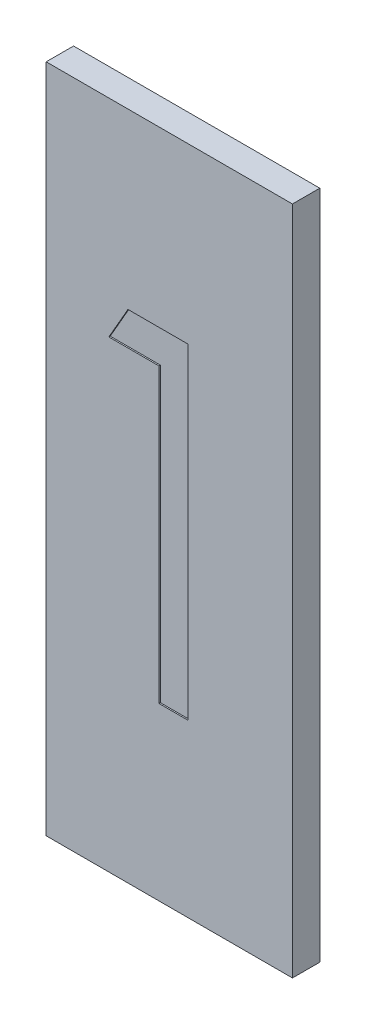
from build123d import *

# Parameters (mm, degrees)
SKETCH_1_W          = 18
SKETCH_1_H          = 49
EXTRUDE_1_DEPTH     = 2
CUT_EXTRUDE_1_DEPTH = 0.1


with BuildPart() as part:
    # ｽｹｯﾁ1 → ﾎﾞｽ - 押し出し1 (new body)
    with BuildSketch(Plane.XY):
        with Locations((9, 24.5)):
            Rectangle(SKETCH_1_W, SKETCH_1_H)
    extrude(amount=EXTRUDE_1_DEPTH)

    # ｽｹｯﾁ2 → ｶｯﾄ - 押し出し1 (cut)
    with BuildSketch(Plane.XY.offset(2)):
        Polygon((5.976975661, 36.3125), (10.379807692, 36.3125), (10.379807692, 12.5), (8.242788462, 12.5), (8.242788462, 33.870192308), (4.579326923, 33.870192308), align=None)
    extrude(amount=-CUT_EXTRUDE_1_DEPTH, mode=Mode.SUBTRACT)


solid = part.part
